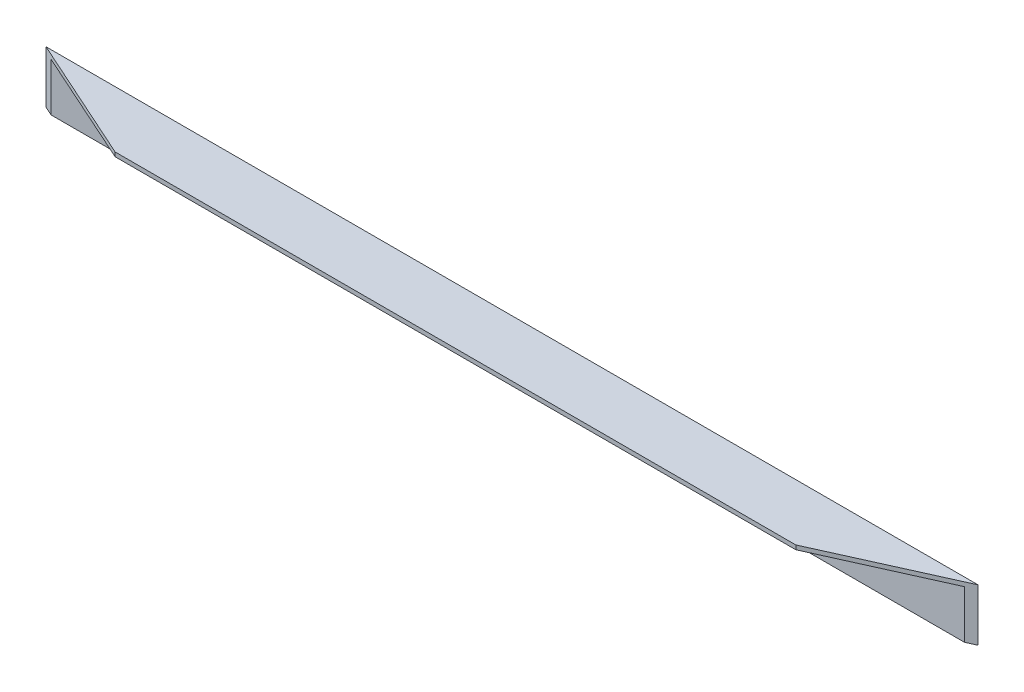
from build123d import *

# Parameters (mm, degrees)
SKETCH_1_W          = 1780
SKETCH_1_H          = 100
EXTRUDE_489_DEPTH   = 8
SKETCH_2_W          = 1780
SKETCH_2_H          = 8
EXTRUDE_1_DEPTH     = 100
CUT_EXTRUDE_1_DEPTH = 903.088687436


with BuildPart() as part:
    # 草图1 → Extrude 489 (new body)
    with BuildSketch(Plane.XY):
        with Locations((0, 50)):
            Rectangle(SKETCH_1_W, SKETCH_1_H)
    extrude(amount=EXTRUDE_489_DEPTH)

    # 草图2 → 凸台-拉伸1 (add)
    with BuildSketch(Plane.XY.offset(8)):
        with Locations((0, 96)):
            Rectangle(SKETCH_2_W, SKETCH_2_H)
    extrude(amount=EXTRUDE_1_DEPTH)

    # 草图3 → 切除-拉伸1 (cut, through all)
    with BuildSketch(Plane(origin=(0, 100, 0), x_dir=(-1, 0, 0), z_dir=(0, 1, 0))):
        Polygon((-650, 108), (-890, 0), (-890, 108), align=None)
        Polygon((890, 108), (650, 108), (890, 0), align=None)
    extrude(amount=-CUT_EXTRUDE_1_DEPTH, mode=Mode.SUBTRACT)


solid = part.part
